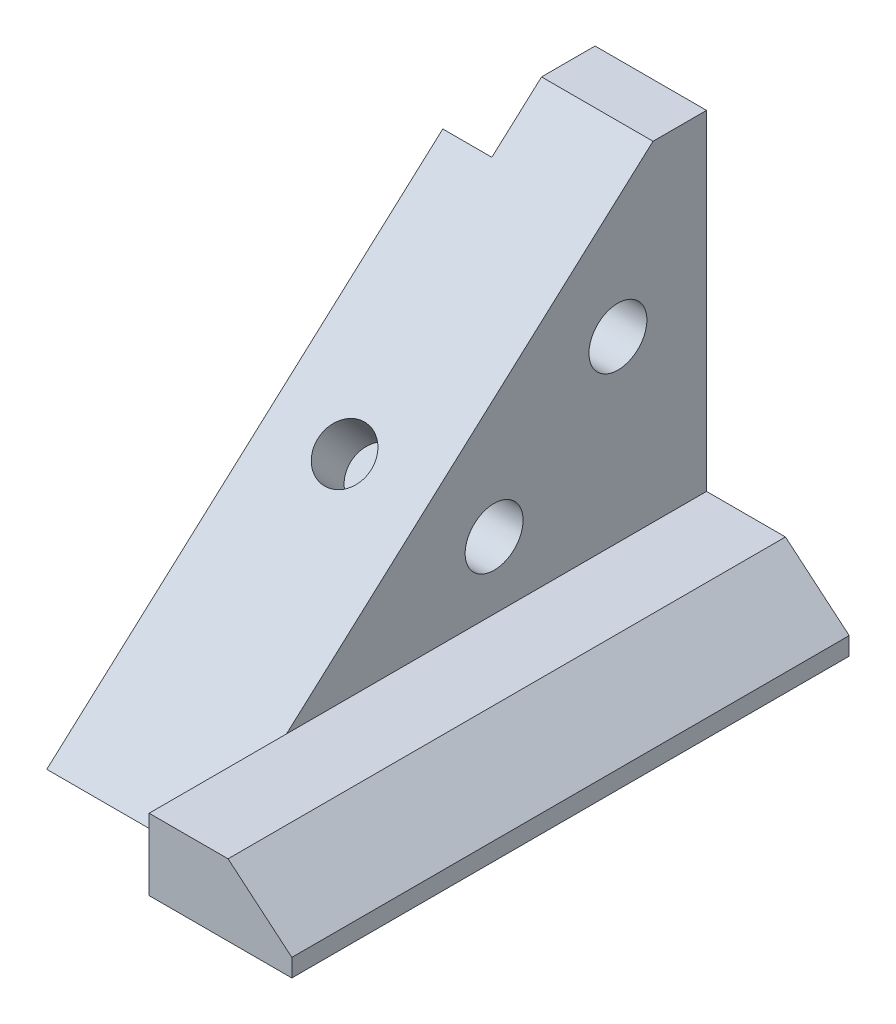
from build123d import *

# Parameters (mm, degrees)
SKETCH1_R               = 6.5
BOSS_EXTRUDE1_DEPTH     = 36
BOSS_EXTRUDE2_START     = 36
SKETCH1_4_W             = 125
SKETCH1_4_H             = 16
BOSS_EXTRUDE2_DEPTH     = 32
CUT_EXTRUDE1_REACH      = 117.453
SKETCH3_W               = 11
SKETCH3_H               = 23.917737905
SKETCH3_6_R             = 6
CUT_EXTRUDE3_DEPTH      = 11
CUT_EXTRUDE4_DEPTH      = 169.371612809
CUT_EXTRUDE4_DEPTH_BACK = 169.371612809


with BuildPart() as part:
    # Sketch1 → Boss-Extrude1 (new body)
    with BuildSketch(Plane(origin=(0, 0, 0), x_dir=(0, 0, -1), z_dir=(1, 0, 0))):
        Polygon((-12, 90), (-111.955126335, 0), (0, 0), (0, 90), align=None)
        with Locations((-47.636607378, 31)):
            Circle(SKETCH1_R, mode=Mode.SUBTRACT)
        with Locations((-19.871294507, 56)):
            Circle(SKETCH1_R, mode=Mode.SUBTRACT)
    extrude(amount=BOSS_EXTRUDE1_DEPTH)

    # Sketch1<4> → Boss-Extrude2 (add)
    with BuildSketch(Plane(origin=(0, 0, 0), x_dir=(0, 0, -1), z_dir=(1, 0, 0)).offset(BOSS_EXTRUDE2_START)):
        with Locations((-62.5, 8)):
            Rectangle(SKETCH1_4_W, SKETCH1_4_H)
    extrude(amount=BOSS_EXTRUDE2_DEPTH)

    # Sketch3 → Cut-Extrude1 (cut, up to next)
    with BuildSketch(Plane(origin=(0, 55.670912219, 50.126314512), x_dir=(1, 0, 0), z_dir=(0, 0.7431448254773979, 0.6691306063588541)), mode=Mode.PRIVATE) as cut_extrude1_sk1:
        with Locations((5.5, 48.262885619)):
            Rectangle(SKETCH3_W, SKETCH3_H)
    cut_extrude1_tool1 = extrude(cut_extrude1_sk1.sketch, amount=-CUT_EXTRUDE1_REACH, mode=Mode.PRIVATE) & part.part
    add(cut_extrude1_tool1.solids().sort_by_distance((5.5, 87.965086, 14.260001))[0], mode=Mode.SUBTRACT)

    # Sketch3<6> → Cut-Extrude3 (cut)
    with BuildSketch(Plane(origin=(0, 55.670912219, 50.126314512), x_dir=(1, 0, 0), z_dir=(0, 0.7431448254773979, 0.6691306063588541))):
        with Locations((17, -16.198872821)):
            Circle(SKETCH3_6_R)
    extrude(amount=-CUT_EXTRUDE3_DEPTH, mode=Mode.SUBTRACT)

    # Sketch4 → Cut-Extrude4 (cut, two sides: drawn at the far end of the back side and taken through both)
    with BuildSketch(Plane.XY.offset(125).offset(-CUT_EXTRUDE4_DEPTH_BACK)):
        Polygon((53.698956889, 16), (68, 4), (68, 16), align=None)
    extrude(amount=CUT_EXTRUDE4_DEPTH + CUT_EXTRUDE4_DEPTH_BACK, mode=Mode.SUBTRACT)


solid = part.part
